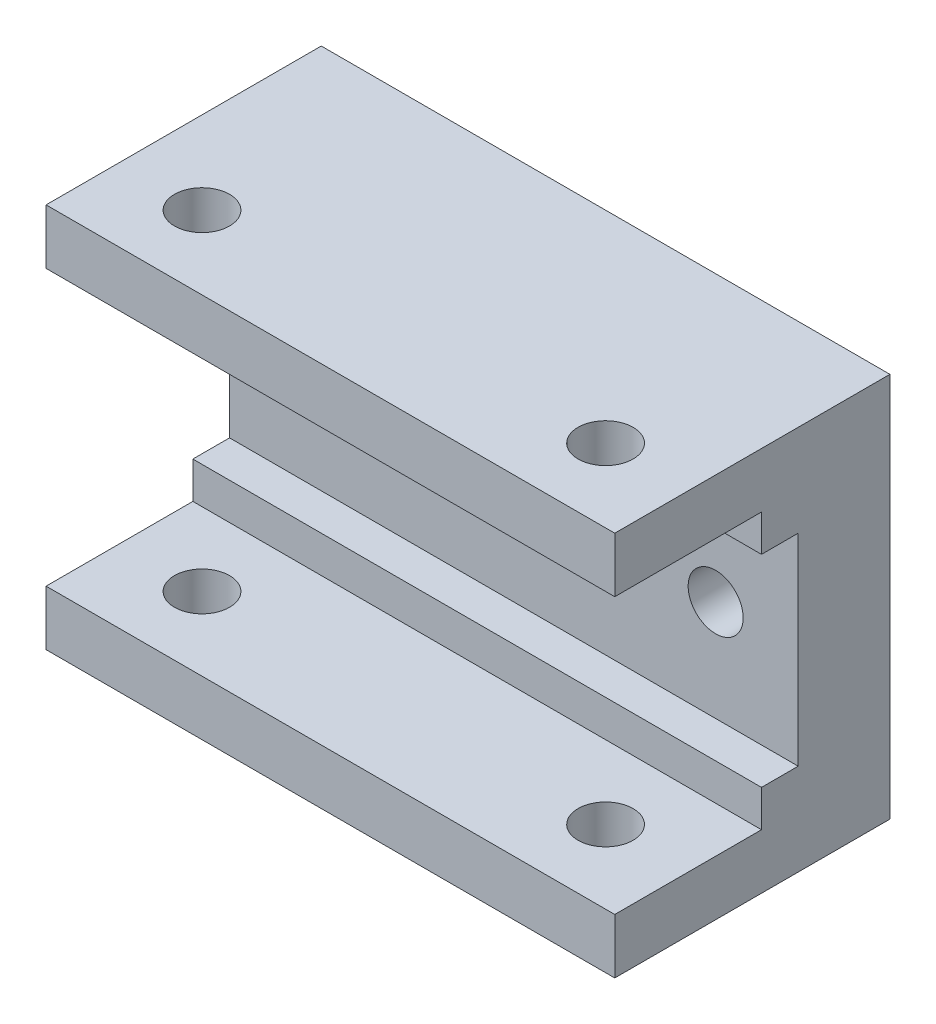
from build123d import *

# Parameters (mm, degrees)
SKETCH_1_W          = 31
SKETCH_1_H          = 21
EXTRUDE_1_DEPTH     = 5
SKETCH_2_W          = 31
SKETCH_2_H          = 3
EXTRUDE_2_DEPTH     = 10
SKETCH_5_R          = 1.5
CUT_EXTRUDE_2_DEPTH = 31.103986447
SKETCH_6_R          = 1.5
CUT_EXTRUDE_3_DEPTH = 24.989581072
SKETCH_7_W          = 31
SKETCH_7_H          = 2
EXTRUDE_3_DEPTH     = 2


with BuildPart() as part:
    # 草图1 → 凸台-拉伸1 (new body)
    with BuildSketch(Plane.XY):
        Rectangle(SKETCH_1_W, SKETCH_1_H)
    extrude(amount=EXTRUDE_1_DEPTH)

    # 草图2 → 凸台-拉伸2 (add)
    with BuildSketch(Plane.XY.offset(5)):
        with Locations((0, 9)):
            Rectangle(SKETCH_2_W, SKETCH_2_H)
        with Locations((0, -9)):
            Rectangle(SKETCH_2_W, SKETCH_2_H)
    extrude(amount=EXTRUDE_2_DEPTH)

    # 草图5 → 切除-拉伸2 (cut, through all)
    with BuildSketch(Plane(origin=(0, 10.5, 0), x_dir=(1, 0, 0), z_dir=(0, 1, 0))):
        with Locations(Location((11, -11, 0), (0, 0, 270))):
            Circle(SKETCH_5_R)
        with Locations(Location((-11, -11, 0), (0, 0, 270))):
            Circle(SKETCH_5_R)
    extrude(amount=-CUT_EXTRUDE_2_DEPTH, mode=Mode.SUBTRACT)

    # 草图6 → 切除-拉伸3 (cut, through all)
    with BuildSketch(Plane(origin=(0, 0, 0), x_dir=(-1, 0, 0), z_dir=(0, 0, -1))):
        with Locations((-11, 0)):
            Circle(SKETCH_6_R)
        with Locations(Location((11, 0, 0), (0, 0, 180))):
            Circle(SKETCH_6_R)
    extrude(amount=-CUT_EXTRUDE_3_DEPTH, mode=Mode.SUBTRACT)

    # 草图7 → 凸台-拉伸3 (add)
    with BuildSketch(Plane.XY.offset(5)):
        with Locations((0, -6.5)):
            Rectangle(SKETCH_7_W, SKETCH_7_H)
        with Locations((0, 6.5)):
            Rectangle(SKETCH_7_W, SKETCH_7_H)
    extrude(amount=EXTRUDE_3_DEPTH)


solid = part.part
